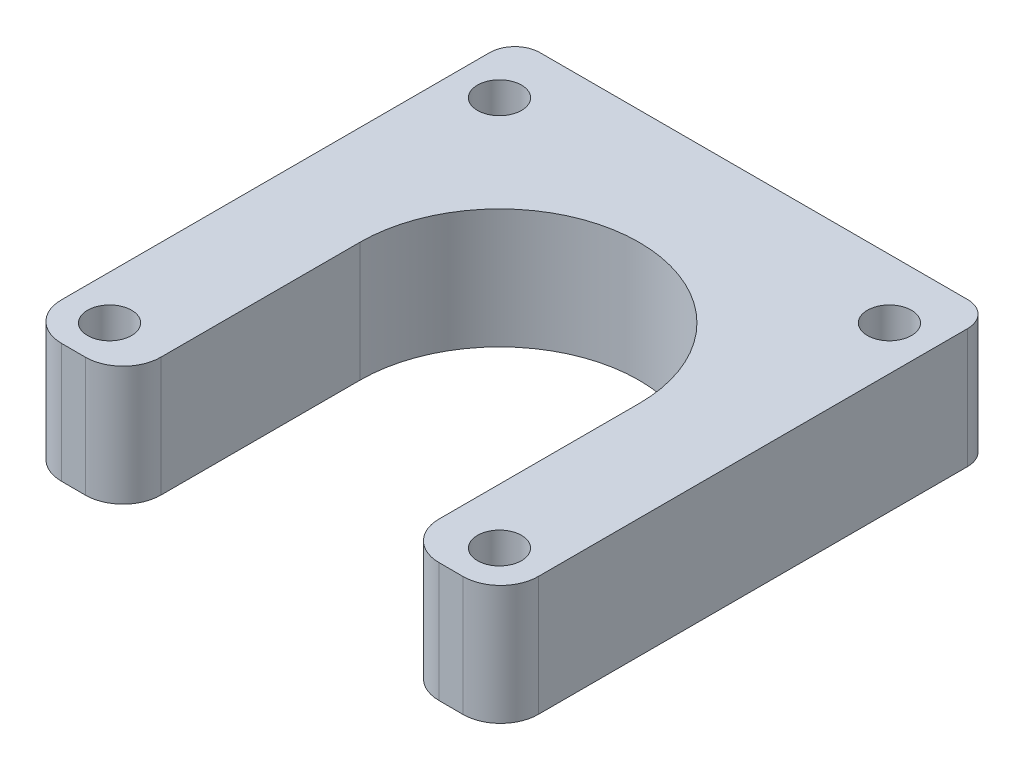
from build123d import *

# Parameters (mm, degrees)
CROQUIS1_R              = 1.75
SALIENTE_EXTRUIR1_DEPTH = 9.5


with BuildPart() as part:
    # Croquis1 → Saliente-Extruir1 (new body)
    with BuildSketch(Plane(origin=(0, 0, 0), x_dir=(1, 0, 0), z_dir=(0, 1, 0))):
        with BuildLine():
            Line((16.499992006, -9.994055242), (16.499992006, -10.627447868))
            ThreePointArc((16.499992006, -10.627447868), (15.618184374, -12.751891582), (13.491151278, -13.627434842))
            Line((13.491151278, -13.627434842), (11.591163268, -13.621835726))
            ThreePointArc((11.591163268, -13.621835726), (9.475560282, -12.740041121), (8.600003995, -10.621848752))
            Line((8.600003995, -10.621848752), (8.600003995, 5.283742))
            ThreePointArc((8.600003995, 5.283742), (-2.499996004, 16.383742), (-13.599996004, 5.283742))
            Line((-13.599996004, 5.283742), (-13.599996004, -10.538745555))
            ThreePointArc((-13.599996004, -10.538745555), (-14.481803636, -12.663189268), (-16.608836732, -13.538732529))
            Line((-16.608836732, -13.538732529), (-18.508832643, -13.533133389))
            ThreePointArc((-18.508832643, -13.533133389), (-20.624435657, -12.651338755), (-21.499991915, -10.533146335))
            Line((-21.499991915, -10.533146335), (-21.499991004, 23.50000907))
            ThreePointArc((-21.499991004, 23.50000907), (-20.914206292, 24.914222817), (-19.499993974, 25.50001098))
            Line((-19.499993974, 25.50001098), (14.499990025, 25.50001098))
            ThreePointArc((14.499990025, 25.50001098), (15.914205688, 24.914224662), (16.499992996, 23.500009))
            Line((16.499992996, 23.500009), (16.499992006, -7.988673633))
            Line((16.499992006, -7.988673633), (16.499992006, -9.994055242))
        make_face()
        with Locations(Location((-17.999996004, -10.216258, 0), (0, 0, 270))):
            Circle(CROQUIS1_R, mode=Mode.SUBTRACT)
        with Locations(Location((-17.999996004, 20.783742, 0), (0, 0, 270))):
            Circle(CROQUIS1_R, mode=Mode.SUBTRACT)
        with Locations(Location((13.000003996, -10.216258, 0), (0, 0, 270))):
            Circle(CROQUIS1_R, mode=Mode.SUBTRACT)
        with Locations(Location((13.000003996, 20.783742, 0), (0, 0, 270))):
            Circle(CROQUIS1_R, mode=Mode.SUBTRACT)
    extrude(amount=SALIENTE_EXTRUIR1_DEPTH)


solid = part.part
